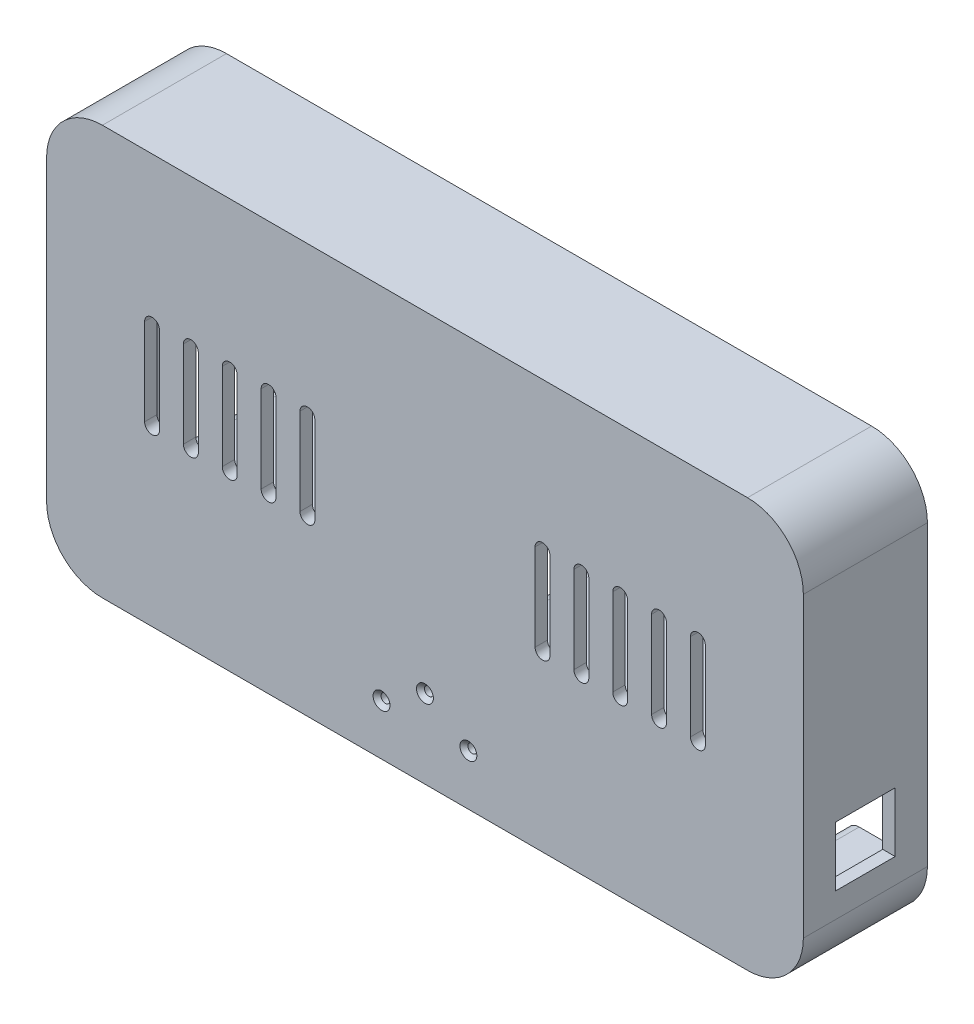
from build123d import *

# Parameters (mm, degrees)
EXTRUDE_1_DEPTH              = 50
CUT_EXTRUDE_1_DEPTH          = 45
CUT_EXTRUDE_2_DEPTH          = 5
CUT_EXTRUDE_3_DEPTH          = 5
SKETCH_1_7_R                 = 2.55
CUT_EXTRUDE_4_DEPTH          = 25
SKETCH_14_R                  = 1.6
SKETCH_14_W                  = 14
SKETCH_14_H                  = 9
USB_DEPTH                    = 5
SKETCH_16_W                  = 24
SKETCH_16_H                  = 24
CUT_EXTRUDE_12_DEPTH         = 5
SKETCH_18_W                  = 24
SKETCH_18_H                  = 24
CUT_EXTRUDE_13_DEPTH         = 5
EXTRUDE_2_DEPTH              = 40
SKETCH_29_5_R                = 3.2
SKETCH_29_5_R_2              = 1
EXTRUDE_5_DEPTH              = 6.5
CUT_EXTRUDE_START            = -2
SKETCH_29_R                  = 1
CUT_EXTRUDE_14_DEPTH         = 2
SKETCH_30_R                  = 1.6
CUT_EXTRUDE_21_DEPTH         = 5
HOLE_WIZARD_M3_1_D           = 3.6
HOLE_WIZARD_M3_1_CSINK_D     = 6.8
HOLE_WIZARD_M3_1_CSINK_ANGLE = 90
CUT_EXTRUDE_23_REACH         = 181.13
FILLET_1_R                   = 5


with BuildPart() as part:
    # 草图1 → 凸台-拉伸1 (new body)
    with BuildSketch(Plane.XY):
        with BuildLine():
            Line((-130, 82.5), (130, 82.5))
            ThreePointArc((130, 82.5), (145.909902577, 75.909902577), (152.5, 60))
            Line((152.5, 60), (152.5, -60))
            ThreePointArc((152.5, -60), (145.909902577, -75.909902577), (130, -82.5))
            Line((130, -82.5), (-130, -82.5))
            ThreePointArc((-130, -82.5), (-145.909902577, -75.909902577), (-152.5, -60))
            Line((-152.5, -60), (-152.5, 60))
            ThreePointArc((-152.5, 60), (-145.909902577, 75.909902577), (-130, 82.5))
        make_face()
    extrude(amount=EXTRUDE_1_DEPTH)

    # 草图1<4> → 切除-拉伸1 (cut)
    with BuildSketch(Plane.XY):
        with BuildLine():
            Line((124.95, 77.5), (-124.85, 77.5))
            Line((-124.85, 77.5), (-124.85, 60))
            ThreePointArc((-124.85, 60), (-126.358400077, 56.358400077), (-130, 54.85))
            Line((-130, 54.85), (-147.5, 54.85))
            Line((-147.5, 54.85), (-147.5, -54.85))
            Line((-147.5, -54.85), (-130, -54.85))
            ThreePointArc((-130, -54.85), (-126.358400077, -56.358400077), (-124.85, -60))
            Line((-124.85, -60), (-124.85, -77.5))
            Line((-124.85, -77.5), (124.95, -77.5))
            Line((124.95, -77.5), (124.95, -60))
            ThreePointArc((124.95, -60), (126.429110755, -56.429110755), (130, -54.95))
            Line((130, -54.95), (147.5, -54.95))
            Line((147.5, -54.95), (147.5, 54.95))
            Line((147.5, 54.95), (130, 54.95))
            ThreePointArc((130, 54.95), (126.429110755, 56.429110755), (124.95, 60))
            Line((124.95, 60), (124.95, 77.5))
        make_face()
    extrude(amount=CUT_EXTRUDE_1_DEPTH, mode=Mode.SUBTRACT)

    # 草图1<5> → 切除-拉伸2 (cut)
    with BuildSketch(Plane.XY):
        with BuildLine():
            ThreePointArc((-150.2, 60), (-144.28355698, 74.28355698), (-130, 80.2))
            Line((-130, 80.2), (130, 80.2))
            ThreePointArc((130, 80.2), (144.28355698, 74.28355698), (150.2, 60))
            Line((150.2, 60), (150.2, -60))
            ThreePointArc((150.2, -60), (144.28355698, -74.28355698), (130, -80.2))
            Line((130, -80.2), (-130, -80.2))
            ThreePointArc((-130, -80.2), (-144.28355698, -74.28355698), (-150.2, -60))
            Line((-150.2, -60), (-150.2, 60))
        make_face()
        with BuildLine():
            Line((-147.5, 60), (-147.5, -60))
            ThreePointArc((-147.5, -60), (-142.374368671, -72.374368671), (-130, -77.5))
            Line((-130, -77.5), (130, -77.5))
            ThreePointArc((130, -77.5), (142.374368671, -72.374368671), (147.5, -60))
            Line((147.5, -60), (147.5, 60))
            ThreePointArc((147.5, 60), (142.374368671, 72.374368671), (130, 77.5))
            Line((130, 77.5), (-130, 77.5))
            ThreePointArc((-130, 77.5), (-142.374368671, 72.374368671), (-147.5, 60))
        make_face(mode=Mode.SUBTRACT)
    extrude(amount=CUT_EXTRUDE_2_DEPTH, mode=Mode.SUBTRACT)

    # 草图1<6> → 切除-拉伸3 (cut)
    with BuildSketch(Plane.XY):
        with BuildLine():
            Line((-124.85, 77.5), (-130, 77.5))
            ThreePointArc((-130, 77.5), (-142.374368671, 72.374368671), (-147.5, 60))
            Line((-147.5, 60), (-147.5, 54.85))
            Line((-147.5, 54.85), (-130, 54.85))
            ThreePointArc((-130, 54.85), (-126.358400077, 56.358400077), (-124.85, 60))
            Line((-124.85, 60), (-124.85, 77.5))
        make_face()
        with BuildLine():
            Line((130, 77.5), (124.95, 77.5))
            Line((124.95, 77.5), (124.95, 60))
            ThreePointArc((124.95, 60), (126.429110755, 56.429110755), (130, 54.95))
            Line((130, 54.95), (147.5, 54.95))
            Line((147.5, 54.95), (147.5, 60))
            ThreePointArc((147.5, 60), (142.374368671, 72.374368671), (130, 77.5))
        make_face()
        with BuildLine():
            Line((-130, -54.85), (-147.5, -54.85))
            Line((-147.5, -54.85), (-147.5, -60))
            ThreePointArc((-147.5, -60), (-142.374368671, -72.374368671), (-130, -77.5))
            Line((-130, -77.5), (-124.85, -77.5))
            Line((-124.85, -77.5), (-124.85, -60))
            ThreePointArc((-124.85, -60), (-126.358400077, -56.358400077), (-130, -54.85))
        make_face()
        with BuildLine():
            Line((147.5, -60), (147.5, -54.95))
            Line((147.5, -54.95), (130, -54.95))
            ThreePointArc((130, -54.95), (126.429110755, -56.429110755), (124.95, -60))
            Line((124.95, -60), (124.95, -77.5))
            Line((124.95, -77.5), (130, -77.5))
            ThreePointArc((130, -77.5), (142.374368671, -72.374368671), (147.5, -60))
        make_face()
    extrude(amount=CUT_EXTRUDE_3_DEPTH, mode=Mode.SUBTRACT)

    # 草图1<7> → 切除-拉伸4 (cut)
    with BuildSketch(Plane.XY):
        with Locations((-130, -60)):
            Circle(SKETCH_1_7_R)
        with Locations((130, 60)):
            Circle(SKETCH_1_7_R)
        with Locations((130, -60)):
            Circle(SKETCH_1_7_R)
        with Locations((-130, 60)):
            Circle(SKETCH_1_7_R)
    extrude(amount=CUT_EXTRUDE_4_DEPTH, mode=Mode.SUBTRACT)

    # 草图14 → USB口 (cut)
    with BuildSketch(Plane.XZ.offset(82.5)):
        with Locations(Location((-70.9, 38, 0), (0, 0, 270))):
            Circle(SKETCH_14_R)
        with Locations(Location((-89.1, 38, 0), (0, 0, 270))):
            Circle(SKETCH_14_R)
        with Locations((-80, 38)):
            Rectangle(SKETCH_14_W, SKETCH_14_H)
    extrude(amount=-USB_DEPTH, mode=Mode.SUBTRACT)

    # 草图16 → 切除-拉伸12 (cut)
    with BuildSketch(Plane(origin=(152.5, 0, 0), x_dir=(0, 0, -1), z_dir=(1, 0, 0))):
        with Locations((-25, -38)):
            Rectangle(SKETCH_16_W, SKETCH_16_H)
    extrude(amount=-CUT_EXTRUDE_12_DEPTH, mode=Mode.SUBTRACT)

    # 草图18 → 切除-拉伸13 (cut)
    with BuildSketch(Plane.ZY.offset(152.5)):
        with Locations((25, -38)):
            Rectangle(SKETCH_18_W, SKETCH_18_H)
    extrude(amount=-CUT_EXTRUDE_13_DEPTH, mode=Mode.SUBTRACT)

    # 草图19 → 凸台-拉伸2 (add)
    with BuildSketch(Plane(origin=(0, 0, 45), x_dir=(-1, 0, 0), z_dir=(0, 0, -1))):
        with BuildLine():
            Line((-103, 40), (-18, 40))
            ThreePointArc((-18, 40), (-14, 36), (-18, 32))
            Line((-18, 32), (-103, 32))
            ThreePointArc((-103, 32), (-107, 36), (-103, 40))
        make_face()
        with BuildLine():
            Line((103, 40), (18, 40))
            ThreePointArc((18, 40), (14, 36), (18, 32))
            Line((18, 32), (103, 32))
            ThreePointArc((103, 32), (107, 36), (103, 40))
        make_face()
        with BuildLine():
            Line((-103, -20), (-23, -20))
            ThreePointArc((-23, -20), (-19, -24), (-23, -28))
            Line((-23, -28), (-103, -28))
            ThreePointArc((-103, -28), (-107, -24), (-103, -20))
        make_face()
        with BuildLine():
            Line((103, -20), (23, -20))
            ThreePointArc((23, -20), (19, -24), (23, -28))
            Line((23, -28), (103, -28))
            ThreePointArc((103, -28), (107, -24), (103, -20))
        make_face()
    extrude(amount=EXTRUDE_2_DEPTH)

    # 草图29<5> → 凸台-拉伸5 (add)
    # profile 1 of 4: a face of its own
    with BuildSketch(Plane(origin=(0, 0, 45), x_dir=(-1, 0, 0), z_dir=(0, 0, -1))):
        with Locations(Location((-30, 20, 0), (0, 0, 180))):
            Circle(SKETCH_29_5_R)
        with Locations(Location((-30, 20, 0), (0, 0, 180))):
            Circle(SKETCH_29_5_R_2, mode=Mode.SUBTRACT)
    # profile 2 of 4: a face of its own
    with BuildSketch(Plane(origin=(0, 0, 45), x_dir=(-1, 0, 0), z_dir=(0, 0, -1))):
        with Locations(Location((-30, -10, 0), (0, 0, 180))):
            Circle(SKETCH_29_5_R)
        with Locations(Location((-30, -10, 0), (0, 0, 180))):
            Circle(SKETCH_29_5_R_2, mode=Mode.SUBTRACT)
    # profile 3 of 4: a face of its own
    with BuildSketch(Plane(origin=(0, 0, 45), x_dir=(-1, 0, 0), z_dir=(0, 0, -1))):
        with Locations(Location((30, 20, 0), (0, 0, 180))):
            Circle(SKETCH_29_5_R)
        with Locations(Location((30, 20, 0), (0, 0, 180))):
            Circle(SKETCH_29_5_R_2, mode=Mode.SUBTRACT)
    # profile 4 of 4: a face of its own
    with BuildSketch(Plane(origin=(0, 0, 45), x_dir=(-1, 0, 0), z_dir=(0, 0, -1))):
        with Locations(Location((30, -10, 0), (0, 0, 180))):
            Circle(SKETCH_29_5_R)
        with Locations(Location((30, -10, 0), (0, 0, 180))):
            Circle(SKETCH_29_5_R_2, mode=Mode.SUBTRACT)
    extrude(amount=EXTRUDE_5_DEPTH)

    # 草图29 → 切除-拉伸14 (cut)
    with BuildSketch(Plane(origin=(0, 0, 45), x_dir=(-1, 0, 0), z_dir=(0, 0, -1)).offset(CUT_EXTRUDE_START)):
        with Locations(Location((-30, 20, 0), (0, 0, 180))):
            Circle(SKETCH_29_R)
        with Locations(Location((30, 20, 0), (0, 0, 180))):
            Circle(SKETCH_29_R)
        with Locations(Location((30, -10, 0), (0, 0, 180))):
            Circle(SKETCH_29_R)
        with Locations(Location((-30, -10, 0), (0, 0, 180))):
            Circle(SKETCH_29_R)
    extrude(amount=CUT_EXTRUDE_14_DEPTH, mode=Mode.SUBTRACT)

    # 草图30 → 切除-拉伸21 (cut)
    with BuildSketch(Plane(origin=(0, 0, 45), x_dir=(-1, 0, 0), z_dir=(0, 0, -1))):
        with Locations((17.5, -62.0866)):
            Circle(SKETCH_30_R)
        with Locations((0, -50.85)):
            Circle(SKETCH_30_R)
        with Locations((-17.5, -62.0866)):
            Circle(SKETCH_30_R)
    extrude(amount=-CUT_EXTRUDE_21_DEPTH, mode=Mode.SUBTRACT)

    # M3 平头机械螺钉的锥形沉头孔1 (through all)
    with Locations(Plane.XY.offset(50)):
        with Locations((17.5, -62.0866), (0, -50.85), (-17.5, -62.0866)):
            CounterSinkHole(HOLE_WIZARD_M3_1_D / 2, HOLE_WIZARD_M3_1_CSINK_D / 2, counter_sink_angle=HOLE_WIZARD_M3_1_CSINK_ANGLE)

    # 草图38 → 切除-拉伸23 (cut, up to next)
    with BuildSketch(Plane(origin=(0, 0, 45), x_dir=(-1, 0, 0), z_dir=(0, 0, -1)), mode=Mode.PRIVATE) as cut_extrude_23_sk1:
        with BuildLine():
            Line((-107, 22.5), (-107, -12.5))
            ThreePointArc((-107, -12.5), (-110, -15.5), (-113, -12.5))
            Line((-113, -12.5), (-113, 22.5))
            ThreePointArc((-113, 22.5), (-110, 25.5), (-107, 22.5))
        make_face()
    cut_extrude_23_tool1 = extrude(cut_extrude_23_sk1.sketch, amount=-CUT_EXTRUDE_23_REACH, mode=Mode.PRIVATE) & part.part
    # 草图38 → 切除-拉伸23 (cut, up to next)
    with BuildSketch(Plane(origin=(0, 0, 45), x_dir=(-1, 0, 0), z_dir=(0, 0, -1)), mode=Mode.PRIVATE) as cut_extrude_23_sk2:
        with BuildLine():
            Line((-97.343565249, 22.5), (-97.343565249, -12.5))
            ThreePointArc((-97.343565249, -12.5), (-94.343565249, -15.5), (-91.343565249, -12.5))
            Line((-91.343565249, -12.5), (-91.343565249, 22.5))
            ThreePointArc((-91.343565249, 22.5), (-94.343565249, 25.5), (-97.343565249, 22.5))
        make_face()
    cut_extrude_23_tool2 = extrude(cut_extrude_23_sk2.sketch, amount=-CUT_EXTRUDE_23_REACH, mode=Mode.PRIVATE) & part.part
    # 草图38 → 切除-拉伸23 (cut, up to next)
    with BuildSketch(Plane(origin=(0, 0, 45), x_dir=(-1, 0, 0), z_dir=(0, 0, -1)), mode=Mode.PRIVATE) as cut_extrude_23_sk3:
        with BuildLine():
            Line((-81.687130498, 22.5), (-81.687130498, -12.5))
            ThreePointArc((-81.687130498, -12.5), (-78.687130498, -15.5), (-75.687130498, -12.5))
            Line((-75.687130498, -12.5), (-75.687130498, 22.5))
            ThreePointArc((-75.687130498, 22.5), (-78.687130498, 25.5), (-81.687130498, 22.5))
        make_face()
    cut_extrude_23_tool3 = extrude(cut_extrude_23_sk3.sketch, amount=-CUT_EXTRUDE_23_REACH, mode=Mode.PRIVATE) & part.part
    # 草图38 → 切除-拉伸23 (cut, up to next)
    with BuildSketch(Plane(origin=(0, 0, 45), x_dir=(-1, 0, 0), z_dir=(0, 0, -1)), mode=Mode.PRIVATE) as cut_extrude_23_sk4:
        with BuildLine():
            Line((-66.030695747, 22.5), (-66.030695747, -12.5))
            ThreePointArc((-66.030695747, -12.5), (-63.030695747, -15.5), (-60.030695747, -12.5))
            Line((-60.030695747, -12.5), (-60.030695747, 22.5))
            ThreePointArc((-60.030695747, 22.5), (-63.030695747, 25.5), (-66.030695747, 22.5))
        make_face()
    cut_extrude_23_tool4 = extrude(cut_extrude_23_sk4.sketch, amount=-CUT_EXTRUDE_23_REACH, mode=Mode.PRIVATE) & part.part
    # 草图38 → 切除-拉伸23 (cut, up to next)
    with BuildSketch(Plane(origin=(0, 0, 45), x_dir=(-1, 0, 0), z_dir=(0, 0, -1)), mode=Mode.PRIVATE) as cut_extrude_23_sk5:
        with BuildLine():
            Line((-50.374260997, 22.5), (-50.374260997, -12.5))
            ThreePointArc((-50.374260997, -12.5), (-47.374260997, -15.5), (-44.374260997, -12.5))
            Line((-44.374260997, -12.5), (-44.374260997, 22.5))
            ThreePointArc((-44.374260997, 22.5), (-47.374260997, 25.5), (-50.374260997, 22.5))
        make_face()
    cut_extrude_23_tool5 = extrude(cut_extrude_23_sk5.sketch, amount=-CUT_EXTRUDE_23_REACH, mode=Mode.PRIVATE) & part.part
    # 草图38 → 切除-拉伸23 (cut, up to next)
    with BuildSketch(Plane(origin=(0, 0, 45), x_dir=(-1, 0, 0), z_dir=(0, 0, -1)), mode=Mode.PRIVATE) as cut_extrude_23_sk6:
        with BuildLine():
            Line((107, 22.5), (107, -12.5))
            ThreePointArc((107, -12.5), (110, -15.5), (113, -12.5))
            Line((113, -12.5), (113, 22.5))
            ThreePointArc((113, 22.5), (110, 25.5), (107, 22.5))
        make_face()
    cut_extrude_23_tool6 = extrude(cut_extrude_23_sk6.sketch, amount=-CUT_EXTRUDE_23_REACH, mode=Mode.PRIVATE) & part.part
    # 草图38 → 切除-拉伸23 (cut, up to next)
    with BuildSketch(Plane(origin=(0, 0, 45), x_dir=(-1, 0, 0), z_dir=(0, 0, -1)), mode=Mode.PRIVATE) as cut_extrude_23_sk7:
        with BuildLine():
            Line((91.343565249, 22.5), (91.343565249, -12.5))
            ThreePointArc((91.343565249, -12.5), (94.343565249, -15.5), (97.343565249, -12.5))
            Line((97.343565249, -12.5), (97.343565249, 22.5))
            ThreePointArc((97.343565249, 22.5), (94.343565249, 25.5), (91.343565249, 22.5))
        make_face()
    cut_extrude_23_tool7 = extrude(cut_extrude_23_sk7.sketch, amount=-CUT_EXTRUDE_23_REACH, mode=Mode.PRIVATE) & part.part
    # 草图38 → 切除-拉伸23 (cut, up to next)
    with BuildSketch(Plane(origin=(0, 0, 45), x_dir=(-1, 0, 0), z_dir=(0, 0, -1)), mode=Mode.PRIVATE) as cut_extrude_23_sk8:
        with BuildLine():
            Line((75.687130498, 22.5), (75.687130498, -12.5))
            ThreePointArc((75.687130498, -12.5), (78.687130498, -15.5), (81.687130498, -12.5))
            Line((81.687130498, -12.5), (81.687130498, 22.5))
            ThreePointArc((81.687130498, 22.5), (78.687130498, 25.5), (75.687130498, 22.5))
        make_face()
    cut_extrude_23_tool8 = extrude(cut_extrude_23_sk8.sketch, amount=-CUT_EXTRUDE_23_REACH, mode=Mode.PRIVATE) & part.part
    # 草图38 → 切除-拉伸23 (cut, up to next)
    with BuildSketch(Plane(origin=(0, 0, 45), x_dir=(-1, 0, 0), z_dir=(0, 0, -1)), mode=Mode.PRIVATE) as cut_extrude_23_sk9:
        with BuildLine():
            Line((60.030695747, 22.5), (60.030695747, -12.5))
            ThreePointArc((60.030695747, -12.5), (63.030695747, -15.5), (66.030695747, -12.5))
            Line((66.030695747, -12.5), (66.030695747, 22.5))
            ThreePointArc((66.030695747, 22.5), (63.030695747, 25.5), (60.030695747, 22.5))
        make_face()
    cut_extrude_23_tool9 = extrude(cut_extrude_23_sk9.sketch, amount=-CUT_EXTRUDE_23_REACH, mode=Mode.PRIVATE) & part.part
    # 草图38 → 切除-拉伸23 (cut, up to next)
    with BuildSketch(Plane(origin=(0, 0, 45), x_dir=(-1, 0, 0), z_dir=(0, 0, -1)), mode=Mode.PRIVATE) as cut_extrude_23_sk10:
        with BuildLine():
            Line((44.374260997, 22.5), (44.374260997, -12.5))
            ThreePointArc((44.374260997, -12.5), (47.374260997, -15.5), (50.374260997, -12.5))
            Line((50.374260997, -12.5), (50.374260997, 22.5))
            ThreePointArc((50.374260997, 22.5), (47.374260997, 25.5), (44.374260997, 22.5))
        make_face()
    cut_extrude_23_tool10 = extrude(cut_extrude_23_sk10.sketch, amount=-CUT_EXTRUDE_23_REACH, mode=Mode.PRIVATE) & part.part
    add(cut_extrude_23_tool1.solids().sort_by_distance((110, 5, 45))[0], mode=Mode.SUBTRACT)
    add(cut_extrude_23_tool2.solids().sort_by_distance((94.343565, 5, 45))[0], mode=Mode.SUBTRACT)
    add(cut_extrude_23_tool3.solids().sort_by_distance((78.68713, 5, 45))[0], mode=Mode.SUBTRACT)
    add(cut_extrude_23_tool4.solids().sort_by_distance((63.030696, 5, 45))[0], mode=Mode.SUBTRACT)
    add(cut_extrude_23_tool5.solids().sort_by_distance((47.374261, 5, 45))[0], mode=Mode.SUBTRACT)
    add(cut_extrude_23_tool6.solids().sort_by_distance((-110, 5, 45))[0], mode=Mode.SUBTRACT)
    add(cut_extrude_23_tool7.solids().sort_by_distance((-94.343565, 5, 45))[0], mode=Mode.SUBTRACT)
    add(cut_extrude_23_tool8.solids().sort_by_distance((-78.68713, 5, 45))[0], mode=Mode.SUBTRACT)
    add(cut_extrude_23_tool9.solids().sort_by_distance((-63.030696, 5, 45))[0], mode=Mode.SUBTRACT)
    add(cut_extrude_23_tool10.solids().sort_by_distance((-47.374261, 5, 45))[0], mode=Mode.SUBTRACT)

    # 圆角1
    fillet_1_edges = [part.edges().sort_by_distance(p)[0] for p in [
        (26.8, 20, 45),
        (26.8, -10, 45),
        (-33.2, 20, 45),
        (-33.2, -10, 45),
    ]]
    fillet(fillet_1_edges, radius=FILLET_1_R)


solid = part.part
